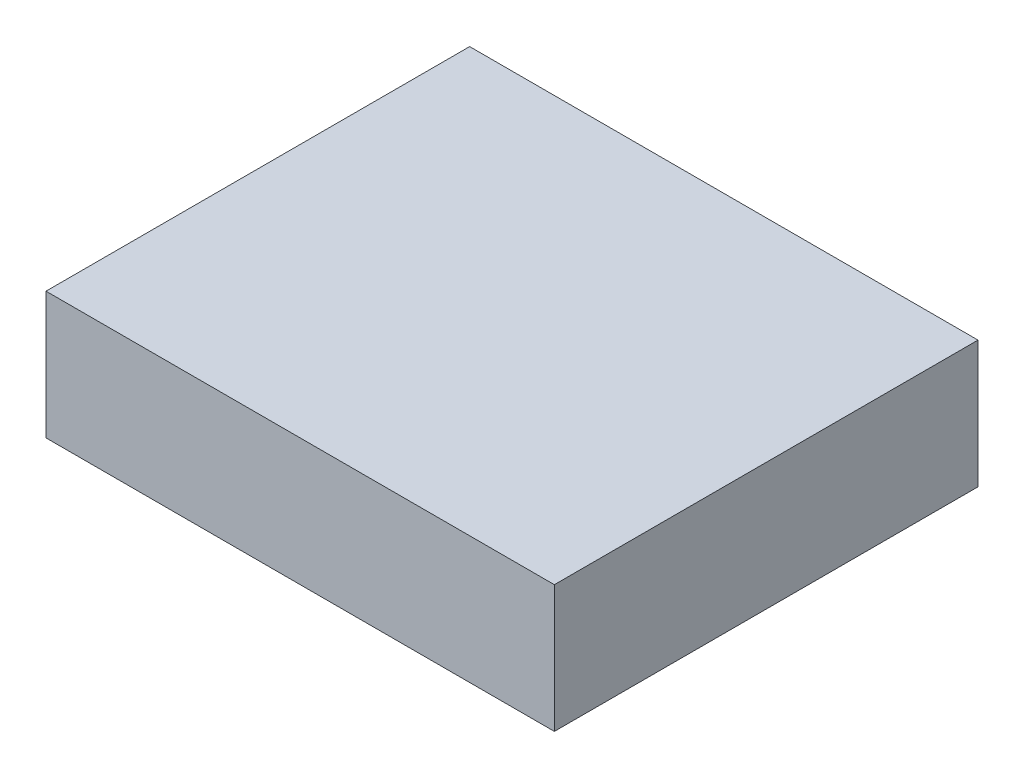
from build123d import *

# Parameters (mm, degrees)
BOSS_EXTRUDE2_DEPTH      = 300
BOSS_EXTRUDE2_DEPTH_BACK = 300
SKETCH1_W                = 150
SKETCH1_H                = 500


with BuildPart() as part:
    # Sketch1 → Boss-Extrude2 (new, two sides: drawn at the far end of the back side and taken through both)
    with BuildSketch(Plane.YZ.offset(-BOSS_EXTRUDE2_DEPTH_BACK)):
        with Locations((-525, -250)):
            Rectangle(SKETCH1_W, SKETCH1_H)
    extrude(amount=BOSS_EXTRUDE2_DEPTH + BOSS_EXTRUDE2_DEPTH_BACK)


solid = part.part
